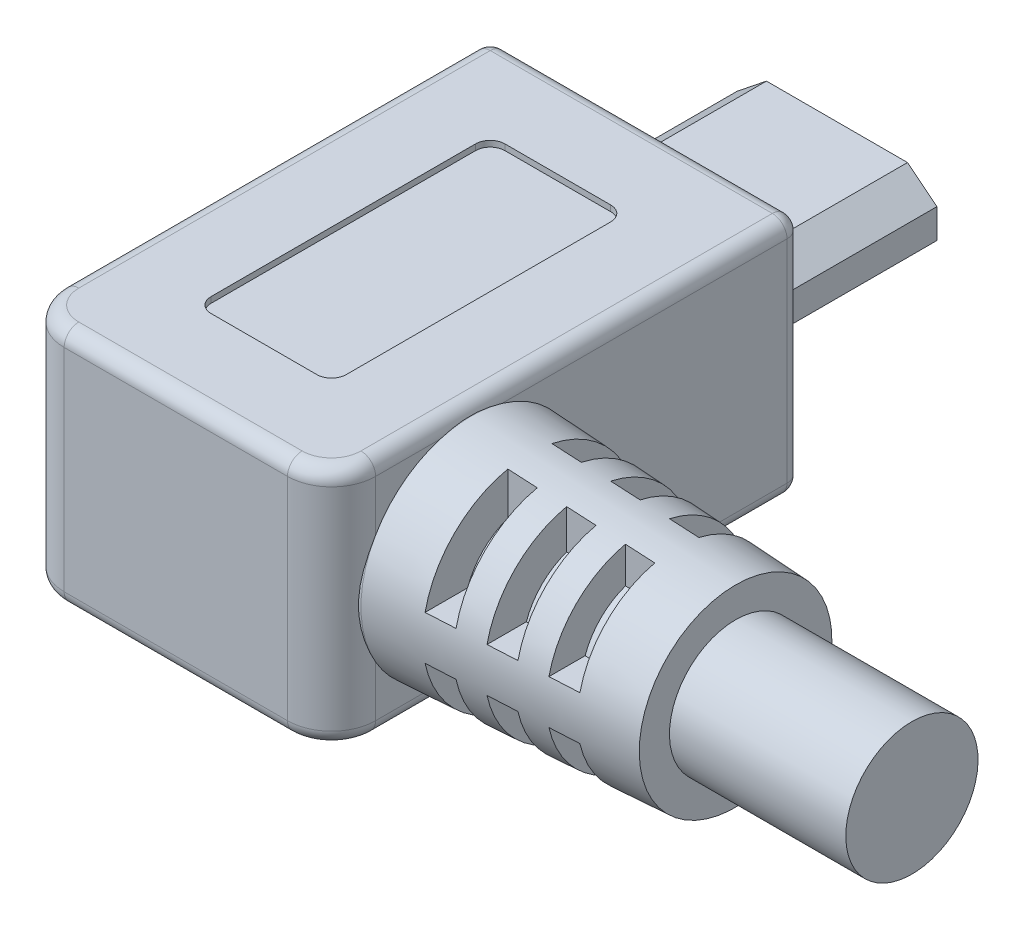
from build123d import *

# Parameters (mm, degrees)
BOSS_EXTRUDE1_DEPTH           = 6.5
SKETCH2_W                     = 10.6
SKETCH2_H                     = 8.2
BOSS_EXTRUDE2_DEPTH           = 16
SKETCH6_W                     = 4.6
SKETCH6_H                     = 10
CUT_EXTRUDE2_DEPTH            = 0.2
FILLET3_R                     = 0.5
FILLET3_OF_MIRROR2_R          = 0.5
FILLET1_R                     = 1.5
FILLET2_R                     = 0.5
SKETCH3_R                     = 3.75
BOSS_EXTRUDE3_DEPTH           = 9
BOSS_EXTRUDE3_TAPER           = 3
BOSS_EXTRUDE3_OTHER_WAY_DEPTH = 8.7
SKETCH5_W                     = 1
SKETCH5_H                     = 2.895184441
CUT_EXTRUDE1_DEPTH            = 3.35
SKETCH4_R                     = 2.25
BOSS_EXTRUDE4_DEPTH           = 15


with BuildPart() as part:
    # Sketch1 → Boss-Extrude1 (new body)
    with BuildSketch(Plane.XY):
        Polygon((1, 1.8), (0, 1), (0, 0), (3.4, 0), (3.4, 0.2), (1.55, 0.2), (1.55, 0.85), (3.4, 0.85), (3.4, 1.8), align=None)
        Polygon((5.8, 1.8), (3.4, 1.8), (3.4, 0.85), (5.25, 0.85), (5.25, 0.2), (3.4, 0.2), (3.4, 0), (6.8, 0), (6.8, 1), align=None)
    extrude(amount=BOSS_EXTRUDE1_DEPTH)

    # Sketch2 → Boss-Extrude2 (add)
    with BuildSketch(Plane.XY.offset(6.5)):
        with Locations((3.4, 0.9)):
            Rectangle(SKETCH2_W, SKETCH2_H)
    extrude(amount=BOSS_EXTRUDE2_DEPTH)

    # Sketch6 → Cut-Extrude2 (cut)
    with BuildSketch(Plane(origin=(0, 5, 0), x_dir=(1, 0, 0), z_dir=(0, 1, 0))):
        with Locations((3.4, -14.5)):
            Rectangle(SKETCH6_W, SKETCH6_H)
    cut_extrude2 = extrude(amount=-CUT_EXTRUDE2_DEPTH, mode=Mode.SUBTRACT)

    # Fillet3
    fillet3_edges = [part.edges().sort_by_distance(p)[0] for p in [
        (5.7, 4.9, 9.5),
        (5.7, 4.9, 19.5),
        (1.1, 4.9, 19.5),
        (1.1, 4.9, 9.5),
    ]]
    fillet(fillet3_edges, radius=FILLET3_R)

    # Mirror2: Cut-Extrude2 across plane
    add(cut_extrude2.mirror(Plane.ZX.offset(0.9)), mode=Mode.SUBTRACT)

    # Fillet3 of Mirror2
    fillet3_of_mirror2_edges = [part.edges().sort_by_distance(p)[0] for p in [
        (5.7, -3.1, 9.5),
        (5.7, -3.1, 19.5),
        (1.1, -3.1, 19.5),
        (1.1, -3.1, 9.5),
    ]]
    fillet(fillet3_of_mirror2_edges, radius=FILLET3_OF_MIRROR2_R)

    # Fillet1
    fillet1_edges = [part.edges().sort_by_distance(p)[0] for p in [
        (8.7, 0.9, 22.5),
        (-1.9, 0.9, 22.5),
    ]]
    fillet(fillet1_edges, radius=FILLET1_R)

    # Fillet2
    fillet2_edges = [part.edges().sort_by_distance(p)[0] for p in [
        (3.4, 5, 22.5),
        (3.4, -3.2, 22.5),
        (8.7, -3.2, 13.75),
        (-1.9, -3.2, 13.75),
        (8.260660172, -3.2, 22.060660172),
        (-1.460660172, -3.2, 22.060660172),
        (-1.9, 5, 13.75),
        (8.7, 5, 13.75),
        (8.260660172, 5, 22.060660172),
        (-1.460660172, 5, 22.060660172),
        (8.7, 0.9, 6.5),
        (3.4, 5, 6.5),
        (-1.9, 0.9, 6.5),
        (3.4, -3.2, 6.5),
    ]]
    fillet(fillet2_edges, radius=FILLET2_R)

    # Sketch3 → Boss-Extrude3 (add)
    with BuildSketch(Plane(origin=(8.7, 0, 0), x_dir=(0, 0, -1), z_dir=(1, 0, 0))):
        with Locations((-17.75, 0.9)):
            Circle(SKETCH3_R)
    extrude(amount=BOSS_EXTRUDE3_DEPTH, taper=BOSS_EXTRUDE3_TAPER)

    # Sketch3 → Boss-Extrude3 other way (add)
    with BuildSketch(Plane(origin=(8.7, 0, 0), x_dir=(0, 0, -1), z_dir=(1, 0, 0))):
        with Locations((-17.75, 0.9)):
            Circle(SKETCH3_R)
    extrude(amount=-BOSS_EXTRUDE3_OTHER_WAY_DEPTH)

    # Sketch5 → Cut-Extrude1 (cut)
    with BuildSketch(Plane(origin=(0, 5, 0), x_dir=(1, 0, 0), z_dir=(0, 1, 0))):
        with Locations((11.2, -15.55240778)):
            Rectangle(SKETCH5_W, SKETCH5_H)
        with Locations((13.2, -15.55240778)):
            Rectangle(SKETCH5_W, SKETCH5_H)
        with Locations((15.2, -15.55240778)):
            Rectangle(SKETCH5_W, SKETCH5_H)
        with Locations((11.2, -19.94759222)):
            Rectangle(SKETCH5_W, SKETCH5_H)
        with Locations((13.2, -19.94759222)):
            Rectangle(SKETCH5_W, SKETCH5_H)
        with Locations((15.2, -19.94759222)):
            Rectangle(SKETCH5_W, SKETCH5_H)
    cut_extrude1 = extrude(amount=-CUT_EXTRUDE1_DEPTH, mode=Mode.SUBTRACT)

    # Mirror1: Cut-Extrude1 across plane
    add(cut_extrude1.mirror(Plane.ZX.offset(0.9)), mode=Mode.SUBTRACT)

    # Sketch4 → Boss-Extrude4 (add)
    with BuildSketch(Plane(origin=(8.7, 0, 0), x_dir=(0, 0, -1), z_dir=(1, 0, 0))):
        with Locations(Location((-17.75, 0.9, 0), (0, 0, 90))):
            Circle(SKETCH4_R)
    extrude(amount=BOSS_EXTRUDE4_DEPTH)


solid = part.part
